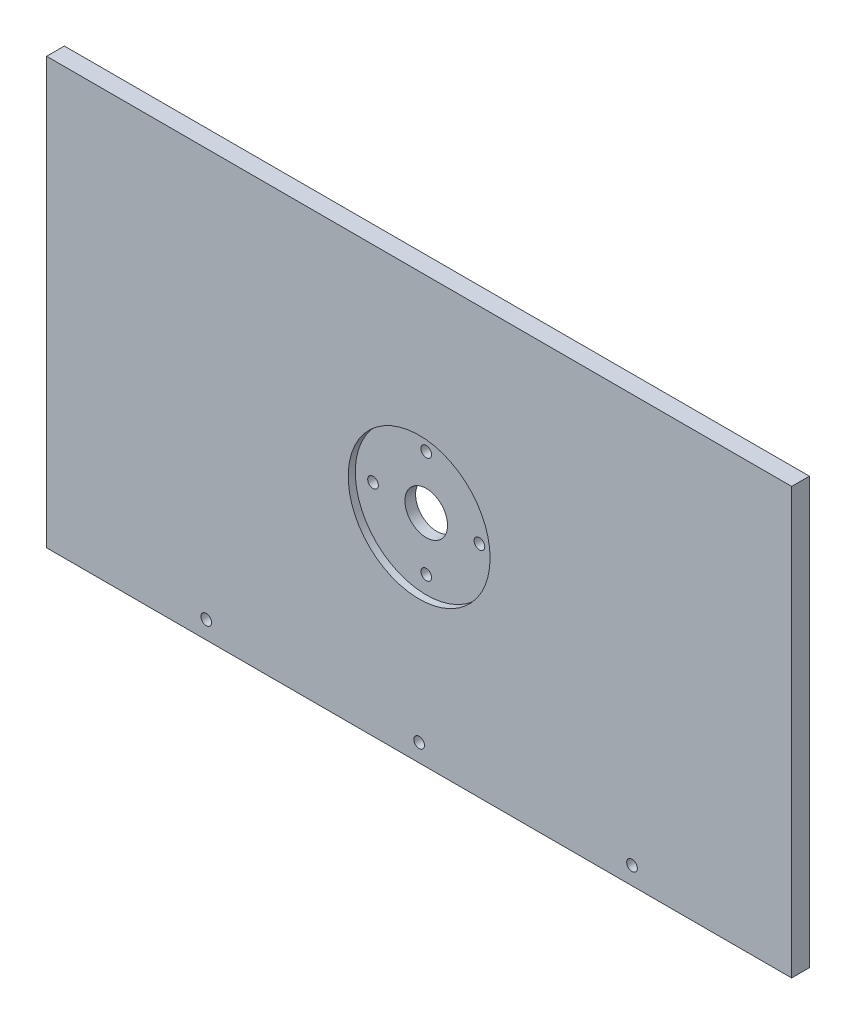
from build123d import *

# Parameters (mm, degrees)
SKETCH1_W           = 210
SKETCH1_H           = 120
BOSS_EXTRUDE1_DEPTH = 5
CUT_EXTRUDE1_DEPTH  = 2
SKETCH3_R           = 1.5
CUT_EXTRUDE3_DEPTH  = 5
SKETCH4_R           = 6
CUT_EXTRUDE4_DEPTH  = 5
SKETCH5_R           = 1.5
CUT_EXTRUDE5_DEPTH  = 10


with BuildPart() as part:
    # Sketch1 → Boss-Extrude1 (new body)
    with BuildSketch(Plane.XY):
        with Locations((105, -60)):
            Rectangle(SKETCH1_W, SKETCH1_H)
    extrude(amount=BOSS_EXTRUDE1_DEPTH)

    # Sketch2 → Cut-Extrude1 (cut)
    with BuildSketch(Plane.XY.offset(5)):
        with BuildLine():
            ThreePointArc((125, -60), (105, -40), (85, -60))
            Line((85, -60), (125, -60))
        make_face()
        with BuildLine():
            Line((125, -60), (85, -60))
            ThreePointArc((85, -60), (105, -80), (125, -60))
        make_face()
    extrude(amount=-CUT_EXTRUDE1_DEPTH, mode=Mode.SUBTRACT)

    # Sketch3 → Cut-Extrude3 (cut)
    with BuildSketch(Plane.XY.offset(3)):
        with Locations((105, -45)):
            Circle(SKETCH3_R)
        with Locations((120, -60)):
            Circle(SKETCH3_R)
        with Locations((105, -75)):
            Circle(SKETCH3_R)
        with Locations((90, -60)):
            Circle(SKETCH3_R)
    extrude(amount=-CUT_EXTRUDE3_DEPTH, mode=Mode.SUBTRACT)

    # Sketch4 → Cut-Extrude4 (cut)
    with BuildSketch(Plane.XY.offset(3)):
        with Locations((105, -60)):
            Circle(SKETCH4_R)
    extrude(amount=-CUT_EXTRUDE4_DEPTH, mode=Mode.SUBTRACT)

    # Sketch5 → Cut-Extrude5 (cut)
    with BuildSketch(Plane.XY.offset(5)):
        with Locations((45, -115)):
            Circle(SKETCH5_R)
        with Locations((105, -115)):
            Circle(SKETCH5_R)
        with Locations((165, -115)):
            Circle(SKETCH5_R)
    extrude(amount=-CUT_EXTRUDE5_DEPTH, mode=Mode.SUBTRACT)


solid = part.part
